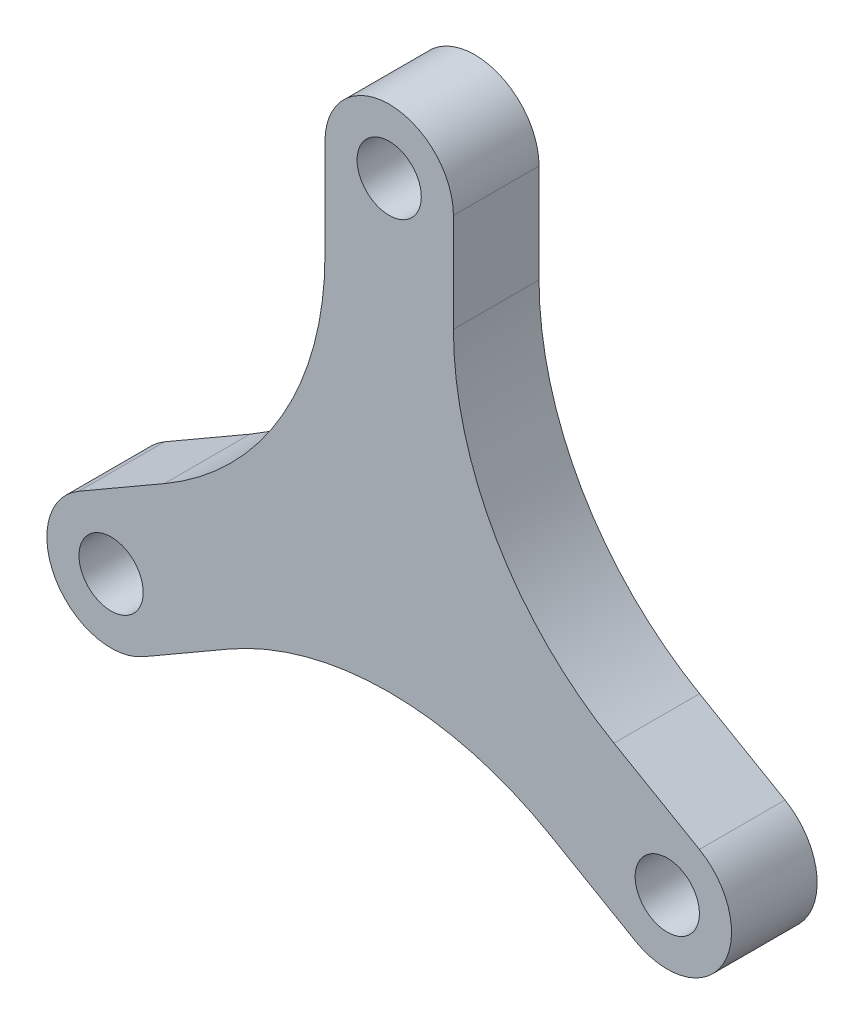
from build123d import *

# Parameters (mm, degrees)
SKETCH_1_R      = 1.5
EXTRUDE_1_DEPTH = 4
FILLET_1_R      = 15


with BuildPart() as part:
    # 草图1 → 凸台-拉伸1 (new body)
    with BuildSketch(Plane.XY):
        with BuildLine():
            Line((-3, 15), (-3, 1.732050808))
            Line((-3, 1.732050808), (-14.490381057, -4.901923789))
            ThreePointArc((-14.490381057, -4.901923789), (-15.588457268, -9), (-11.490381057, -10.098076211))
            Line((-11.490381057, -10.098076211), (0, -3.464101615))
            Line((0, -3.464101615), (11.490381057, -10.098076211))
            ThreePointArc((11.490381057, -10.098076211), (15.588457268, -9), (14.490381057, -4.901923789))
            Line((14.490381057, -4.901923789), (3, 1.732050808))
            Line((3, 1.732050808), (3, 15))
            ThreePointArc((3, 15), (0, 18), (-3, 15))
        make_face()
        with Locations((0, 15)):
            Circle(SKETCH_1_R, mode=Mode.SUBTRACT)
        with Locations((12.990381057, -7.5)):
            Circle(SKETCH_1_R, mode=Mode.SUBTRACT)
        with Locations((-12.990381057, -7.5)):
            Circle(SKETCH_1_R, mode=Mode.SUBTRACT)
    extrude(amount=EXTRUDE_1_DEPTH)

    # 圆角1
    fillet_1_edges = [part.edges().sort_by_distance(p)[0] for p in [
        (-3, 1.732050808, 2),
        (3, 1.732050808, 2),
        (0, -3.464101615, 2),
    ]]
    fillet(fillet_1_edges, radius=FILLET_1_R)


solid = part.part
